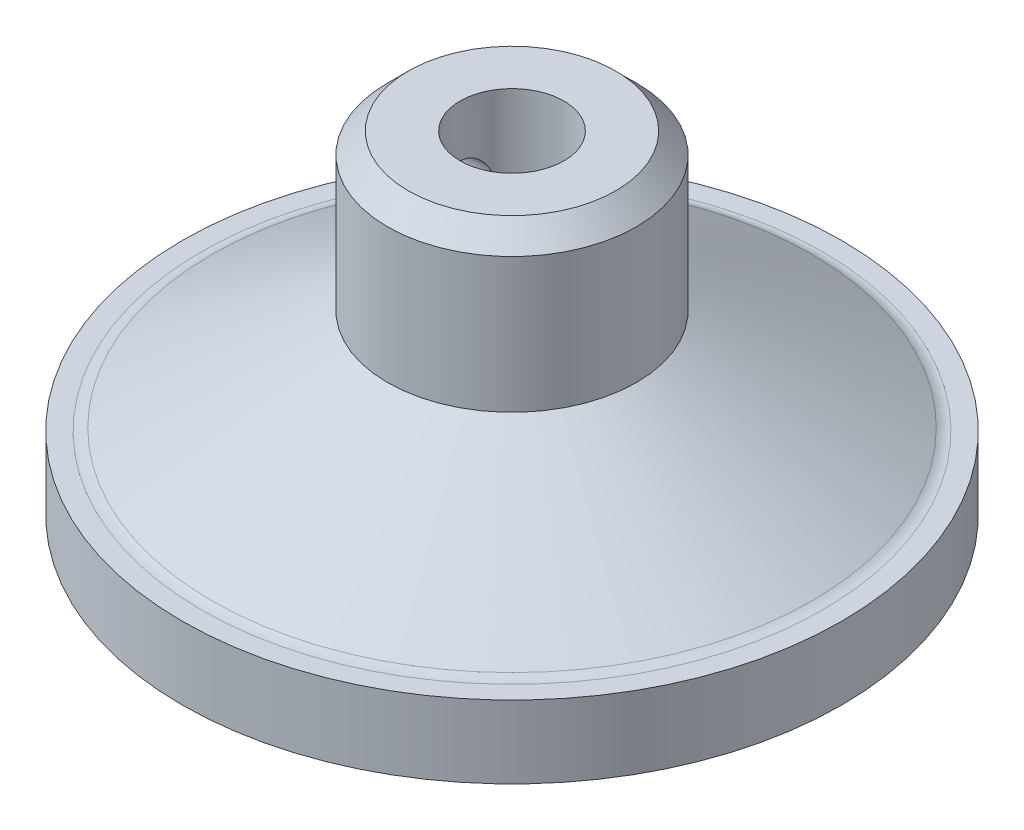
from build123d import *

# Parameters (mm, degrees)
FILLET1_R     = 3
CHAMFER1_SIZE = 1
FILLET2_R     = 1


with BuildPart() as part:
    # Sketch1 → Revolve1 (revolve)
    with BuildSketch(Plane.XY, mode=Mode.PRIVATE) as revolve1_sk:
        Polygon((6, 10.999045222), (2.5, 10.999045222), (2.5, 3.5), (0, 3.5), (0, 0), (5.062177826, 0), (13.75, -5.015916471), (15.887822174, -5.015916471), (15.887822174, -1.515916471), (14.687822174, -1.515916471), (6, 3.5), align=None)
    revolve(revolve1_sk.sketch.rotate(Axis((0, 31.975823544, 0), (0, -1, 0)), 90), axis=Axis((0, 31.975823544, 0), (0, -1, 0)))

    # Fillet1
    fillet1_edges = [part.edges().sort_by_distance(p)[0] for p in [
        (0, -5.015916471, -13.75),
    ]]
    fillet(fillet1_edges, radius=FILLET1_R)

    # Chamfer1
    chamfer1_edges = [part.edges().sort_by_distance(p)[0] for p in [
        (0, 10.999045222, -6),
    ]]
    chamfer(chamfer1_edges, length=CHAMFER1_SIZE)

    # Fillet2
    fillet2_edges = [part.edges().sort_by_distance(p)[0] for p in [
        (0, -1.515916471, -14.687822174),
    ]]
    fillet(fillet2_edges, radius=FILLET2_R)

    # Sketch4 → M3 Tapped Hole1 (revolve, cut)
    with BuildSketch(Plane(origin=(-6, 7.249522611, 0), x_dir=(0, 0, 1), z_dir=(0, 1, 0))):
        Polygon((0, 0), (0, 7.251075774), (1.25, 6.5), (1.25, 0.275), (1.525, 0), align=None)
    revolve(axis=Axis((-12.35, 7.249522611, 0), (1, 0, 0)), mode=Mode.SUBTRACT)


solid = part.part
